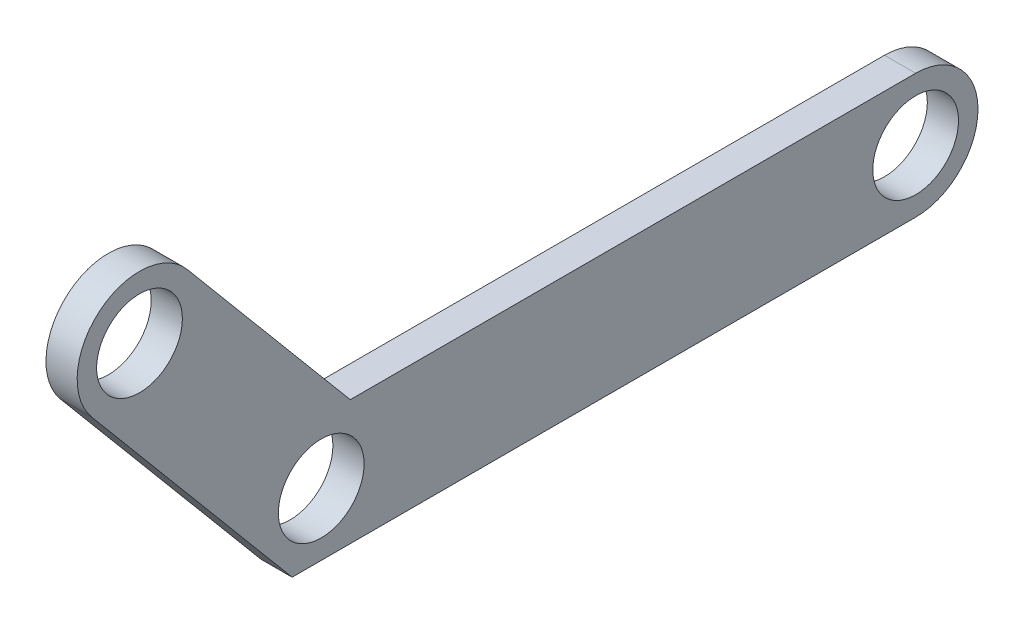
from build123d import *

# Parameters (mm, degrees)
SKETCH1_R           = 2.75
BOSS_EXTRUDE1_DEPTH = 2


with BuildPart() as part:
    # Sketch1 → Boss-Extrude1 (new body)
    with BuildSketch(Plane(origin=(0, 0, 0), x_dir=(0, 0, -1), z_dir=(1, 0, 0))):
        with BuildLine():
            Line((0, 0), (-12.855752194, 15.320888862))
            ThreePointArc((-12.855752194, 15.320888862), (-12.36272486, 20.956217074), (-6.727396649, 20.46318974))
            Line((-6.727396649, 20.46318974), (3.730461265, 8))
            Line((3.730461265, 8), (40, 8))
            ThreePointArc((40, 8), (44, 4), (40, 0))
            Line((40, 0), (0, 0))
        make_face()
        with Locations((-9.791574421, 17.892039301)):
            Circle(SKETCH1_R, mode=Mode.SUBTRACT)
        with Locations((40, 4)):
            Circle(SKETCH1_R, mode=Mode.SUBTRACT)
        with Locations((1.865230633, 4)):
            Circle(SKETCH1_R, mode=Mode.SUBTRACT)
    extrude(amount=BOSS_EXTRUDE1_DEPTH)


solid = part.part
